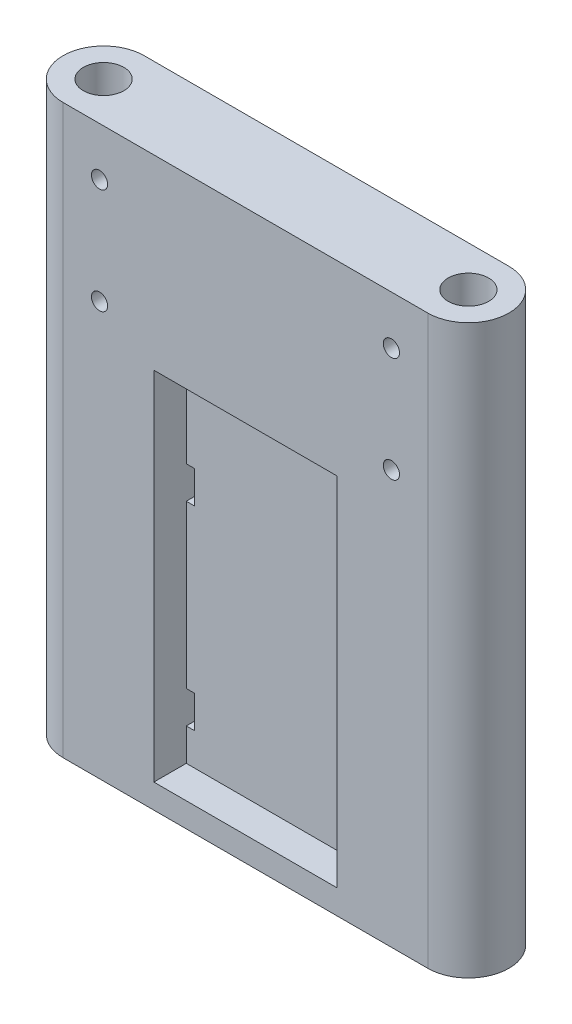
from build123d import *

# Parameters (mm, degrees)
SKETCH2_R           = 3.175
BOSS_EXTRUDE1_DEPTH = 44.45
SKETCH5_R           = 1.27
CUT_EXTRUDE1_DEPTH  = 5.08
CUT_EXTRUDE2_START  = -5.08
SKETCH6_R           = 1.27
CUT_EXTRUDE2_DEPTH  = 5.08
SKETCH7_W           = 28.702
SKETCH7_H           = 55.88
CUT_EXTRUDE3_DEPTH  = 5.08
SKETCH8_W           = 1.27
SKETCH8_H           = 5.08
CUT_EXTRUDE4_DEPTH  = 58.040534053


with BuildPart() as part:
    # Sketch2 → Boss-Extrude1 (new, symmetric)
    with BuildSketch(Plane(origin=(0, 0, 0), x_dir=(1, 0, 0), z_dir=(0, 1, 0))):
        with BuildLine():
            Line((-28.575, 6.35), (28.575, 6.35))
            ThreePointArc((28.575, 6.35), (34.925, 0), (28.575, -6.35))
            Line((28.575, -6.35), (-28.575, -6.35))
            ThreePointArc((-28.575, -6.35), (-34.925, 0), (-28.575, 6.35))
        make_face()
        with Locations(Location((28.575, 0, 0), (0, 0, 270))):
            Circle(SKETCH2_R, mode=Mode.SUBTRACT)
        with Locations(Location((-28.575, 0, 0), (0, 0, 270))):
            Circle(SKETCH2_R, mode=Mode.SUBTRACT)
    extrude(amount=BOSS_EXTRUDE1_DEPTH, both=True)

    # Sketch5 → Cut-Extrude1 (cut)
    with BuildSketch(Plane(origin=(0, 0, -6.35), x_dir=(-1, 0, 0), z_dir=(0, 0, -1))):
        with Locations((22.86, 36.83)):
            Circle(SKETCH5_R)
        with Locations((22.86, 20.32)):
            Circle(SKETCH5_R)
        with Locations((-22.86, 36.83)):
            Circle(SKETCH5_R)
        with Locations((-22.86, 20.32)):
            Circle(SKETCH5_R)
    extrude(amount=-CUT_EXTRUDE1_DEPTH, mode=Mode.SUBTRACT)

    # Sketch6 → Cut-Extrude2 (cut)
    with BuildSketch(Plane.XY.offset(6.35).offset(CUT_EXTRUDE2_START)):
        with Locations(Location((22.86, 36.83, 0), (0, 0, 180))):
            Circle(SKETCH6_R)
        with Locations(Location((22.86, 20.32, 0), (0, 0, 180))):
            Circle(SKETCH6_R)
        with Locations(Location((-22.86, 36.83, 0), (0, 0, 180))):
            Circle(SKETCH6_R)
        with Locations(Location((-22.86, 20.32, 0), (0, 0, 180))):
            Circle(SKETCH6_R)
    extrude(amount=CUT_EXTRUDE2_DEPTH, mode=Mode.SUBTRACT)

    # Sketch7 → Cut-Extrude3 (cut)
    with BuildSketch(Plane.XY.offset(6.35)):
        with Locations((0, -12.7)):
            Rectangle(SKETCH7_W, SKETCH7_H)
    cut_extrude3 = extrude(amount=-CUT_EXTRUDE3_DEPTH, mode=Mode.SUBTRACT)

    # Mirror1: Cut-Extrude3 across plane
    add(cut_extrude3.mirror(Plane.XY), mode=Mode.SUBTRACT)

    # Sketch8 → Cut-Extrude4 (cut, through all)
    with BuildSketch(Plane.XY.offset(1.27)):
        with Locations((13.716, -33.02)):
            Rectangle(SKETCH8_W, SKETCH8_H)
        with Locations((13.716, -2.54)):
            Rectangle(SKETCH8_W, SKETCH8_H)
    cut_extrude4 = extrude(amount=-CUT_EXTRUDE4_DEPTH, mode=Mode.SUBTRACT)

    # Mirror2: Cut-Extrude4 across plane
    add(cut_extrude4.mirror(Plane(origin=(0, 0, 0), x_dir=(0, 0, 1), z_dir=(1, 0, 0))), mode=Mode.SUBTRACT)


solid = part.part
